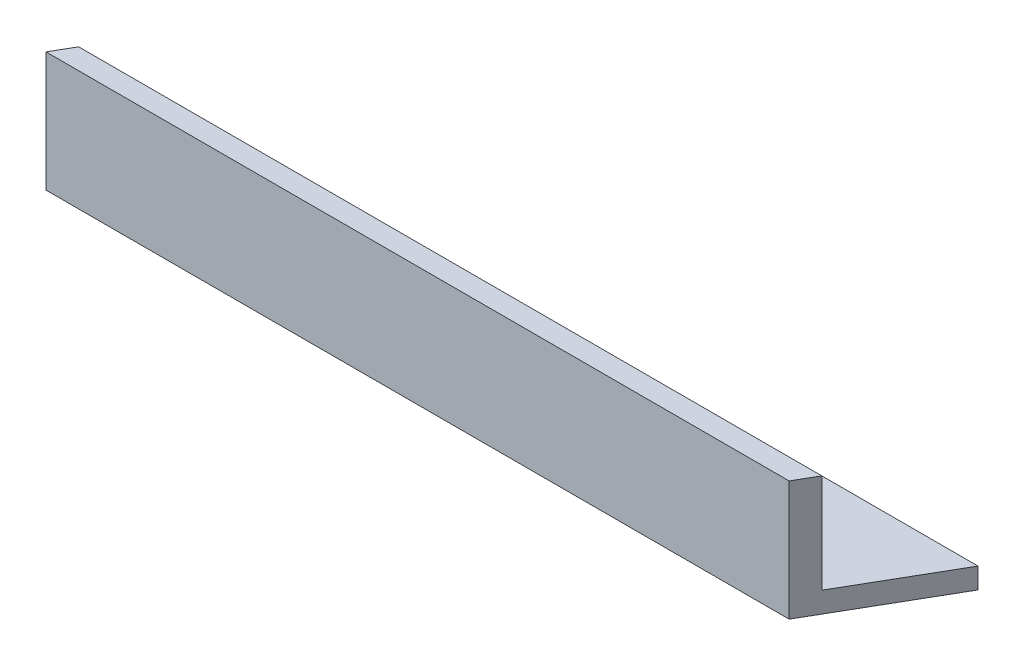
from build123d import *

# Parameters (mm, degrees)
BOSS_EXTRUDE1_DEPTH = 240
CUT_EXTRUDE1_DEPTH  = 242.660919472


with BuildPart() as part:
    # Sketch1 → Boss-Extrude1 (new body)
    with BuildSketch(Plane(origin=(0, 0, 0), x_dir=(0, 0, -1), z_dir=(1, 0, 0))):
        Polygon((0, 0), (20, 0), (20, 3.461178467), (3.461178467, 3.461178467), (3.461178467, 20), (0, 20), align=None)
    extrude(amount=BOSS_EXTRUDE1_DEPTH)

    # Sketch2 → Cut-Extrude1 (cut, through all)
    with BuildSketch(Plane.XZ):
        Polygon((0, 0), (11.547005384, -20), (0, -20), align=None)
        Polygon((240, 0), (240, -20), (135.67731326, -20), (124.130307876, 0), align=None)
    extrude(amount=-CUT_EXTRUDE1_DEPTH, mode=Mode.SUBTRACT)


solid = part.part
